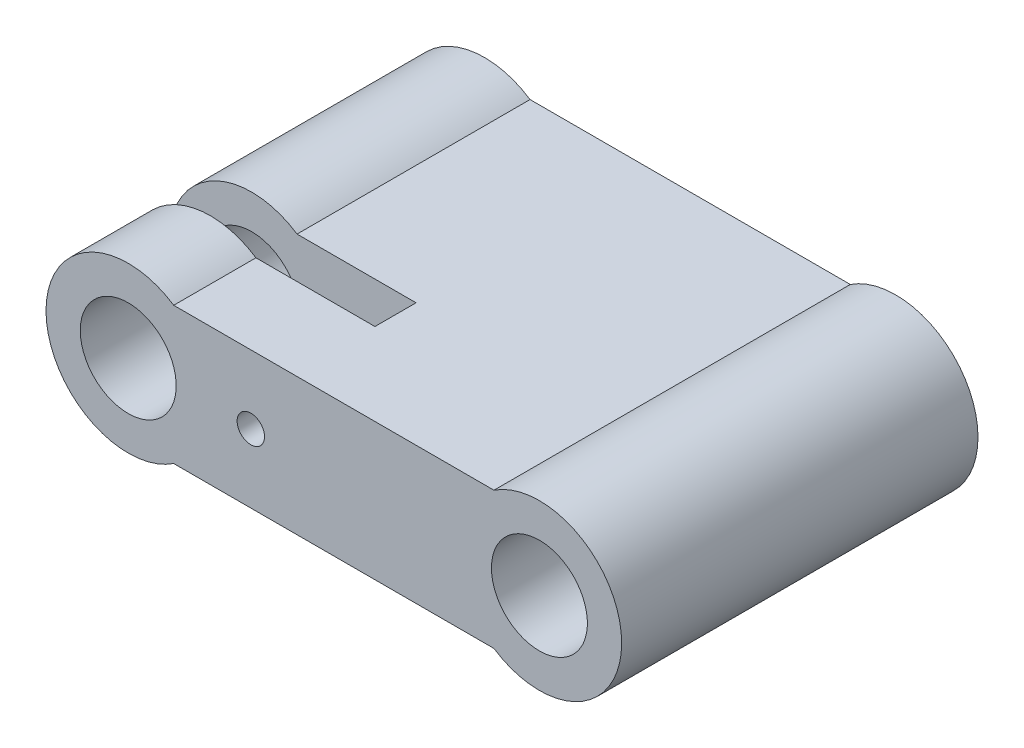
from build123d import *

# Parameters (mm, degrees)
BOSS_EXTRUDE1_START     = 1
SKETCH1_R               = 7
BOSS_EXTRUDE1_DEPTH     = 52
CUT_EXTRUDE1_START      = -18
SKETCH2_R               = 26
CUT_EXTRUDE1_DEPTH      = 6
CUT_EXTRUDE2_DEPTH      = 99.230596048
CUT_EXTRUDE2_DEPTH_BACK = 99.230596048
SKETCH3_R               = 2


with BuildPart() as part:
    # Sketch1 → Boss-Extrude1 (new body)
    with BuildSketch(Plane.XY.offset(BOSS_EXTRUDE1_START)):
        with BuildLine():
            ThreePointArc((-64.866750419, -17), (-83.5, -27), (-64.866750419, -37))
            Line((-64.866750419, -37), (-18.133249581, -37))
            ThreePointArc((-18.133249581, -37), (0.5, -27), (-18.133249581, -17))
            Line((-18.133249581, -17), (-64.866750419, -17))
        make_face()
        with Locations(Location((-71.5, -27, 0), (0, 0, 180))):
            Circle(SKETCH1_R, mode=Mode.SUBTRACT)
        with Locations(Location((-11.5, -27, 0), (0, 0, 180))):
            Circle(SKETCH1_R, mode=Mode.SUBTRACT)
    extrude(amount=BOSS_EXTRUDE1_DEPTH)

    # Sketch2 → Cut-Extrude1 (cut)
    with BuildSketch(Plane.XY.offset(53).offset(CUT_EXTRUDE1_START)):
        with Locations((-71.5, -27)):
            Circle(SKETCH2_R)
    extrude(amount=CUT_EXTRUDE1_DEPTH, mode=Mode.SUBTRACT)

    # Sketch3 → Cut-Extrude2 (cut, two sides: drawn at the far end of the back side and taken through both)
    with BuildSketch(Plane.XY.offset(35).offset(-CUT_EXTRUDE2_DEPTH_BACK)):
        with Locations((-53.61145618, -27)):
            Circle(SKETCH3_R)
    extrude(amount=CUT_EXTRUDE2_DEPTH + CUT_EXTRUDE2_DEPTH_BACK, mode=Mode.SUBTRACT)


solid = part.part
